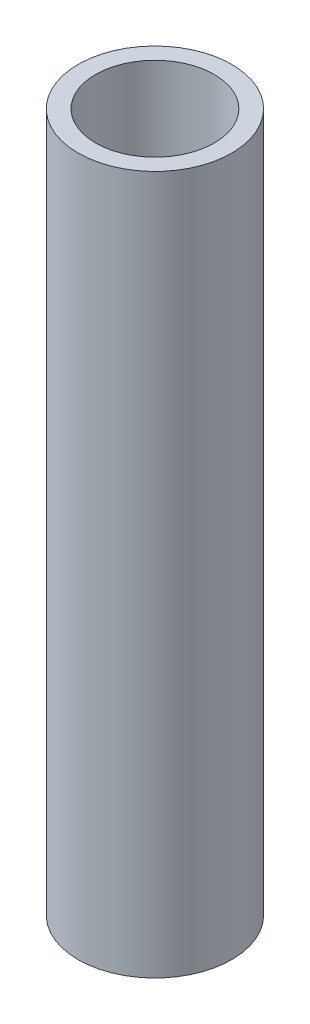
from build123d import *

# Parameters (mm, degrees)
SKETCH1_R           = 11
SKETCH1_R_2         = 8.5
BOSS_EXTRUDE1_DEPTH = 100


with BuildPart() as part:
    # Sketch1 → Boss-Extrude1 (new body)
    with BuildSketch(Plane(origin=(0, 0, 0), x_dir=(1, 0, 0), z_dir=(0, 1, 0))):
        with Locations(Location((0, 0, 0), (0, 0, 270))):
            Circle(SKETCH1_R)
        with Locations(Location((0, 0, 0), (0, 0, 270))):
            Circle(SKETCH1_R_2, mode=Mode.SUBTRACT)
    extrude(amount=BOSS_EXTRUDE1_DEPTH)


solid = part.part
